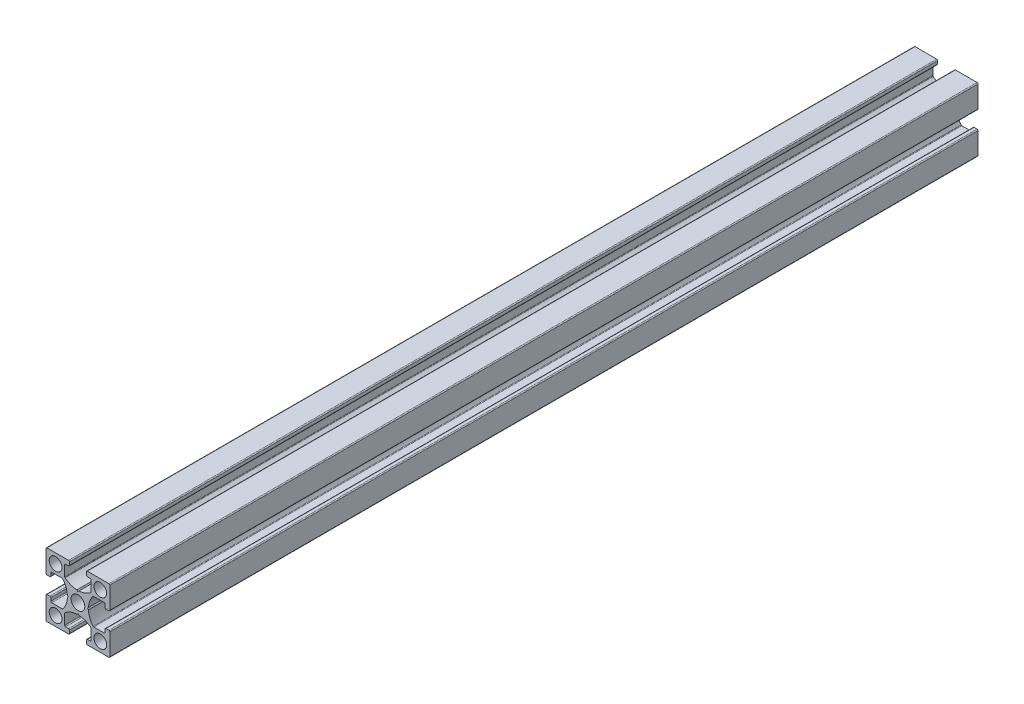
from build123d import *

# Parameters (mm, degrees)
MODEL_R         = 2.15
MODEL_R_2       = 2
EXTRUDE_1_DEPTH = 272


with BuildPart() as part:
    # Model → 보스-돌출1 (new body)
    with BuildSketch(Plane.XY):
        with BuildLine():
            Line((2307.763927197, 1192.134297913), (2307.763927197, 1195.391548465))
            ThreePointArc((2307.763927197, 1195.391548465), (2307.676059232, 1195.603680499), (2307.463927197, 1195.691548465))
            Line((2307.463927197, 1195.691548465), (2306.563927197, 1195.691548465))
            ThreePointArc((2306.563927197, 1195.691548465), (2306.351795163, 1195.779416431), (2306.263927197, 1195.991548465))
            Line((2306.263927197, 1195.991548465), (2306.263927197, 1196.891548465))
            ThreePointArc((2306.263927197, 1196.891548465), (2306.351795163, 1197.103680499), (2306.563927197, 1197.191548465))
            Line((2306.563927197, 1197.191548465), (2313.313927197, 1197.191548465))
            ThreePointArc((2313.313927197, 1197.191548465), (2313.526059232, 1197.103680499), (2313.613927197, 1196.891548465))
            Line((2313.613927197, 1196.891548465), (2313.613927197, 1190.141548465))
            ThreePointArc((2313.613927197, 1190.141548465), (2313.526059232, 1189.929416431), (2313.313927197, 1189.841548465))
            Line((2313.313927197, 1189.841548465), (2312.413927197, 1189.841548465))
            ThreePointArc((2312.413927197, 1189.841548465), (2312.201795163, 1189.929416431), (2312.113927197, 1190.141548465))
            Line((2312.113927197, 1190.141548465), (2312.113927197, 1191.041548465))
            ThreePointArc((2312.113927197, 1191.041548465), (2312.026059232, 1191.253680499), (2311.813927197, 1191.341548465))
            Line((2311.813927197, 1191.341548465), (2308.556676645, 1191.341548465))
            ThreePointArc((2308.556676645, 1191.341548465), (2308.426234796, 1191.311705686), (2308.321744595, 1191.228114625))
            ThreePointArc((2308.321744595, 1191.228114625), (2307.328306374, 1189.47356999), (2306.921204563, 1187.498825831))
            Line((2306.921204563, 1187.498825831), (2306.613927197, 1187.191548465))
            Line((2306.613927197, 1187.191548465), (2306.921204563, 1186.884271099))
            ThreePointArc((2306.921204563, 1186.884271099), (2307.328306374, 1184.90952694), (2308.321744595, 1183.154982305))
            ThreePointArc((2308.321744595, 1183.154982305), (2308.426234796, 1183.071391244), (2308.556676645, 1183.041548465))
            Line((2308.556676645, 1183.041548465), (2311.813927197, 1183.041548465))
            ThreePointArc((2311.813927197, 1183.041548465), (2312.026059232, 1183.129416431), (2312.113927197, 1183.341548465))
            Line((2312.113927197, 1183.341548465), (2312.113927197, 1184.241548465))
            ThreePointArc((2312.113927197, 1184.241548465), (2312.201795163, 1184.453680499), (2312.413927197, 1184.541548465))
            Line((2312.413927197, 1184.541548465), (2313.313927197, 1184.541548465))
            ThreePointArc((2313.313927197, 1184.541548465), (2313.526059232, 1184.453680499), (2313.613927197, 1184.241548465))
            Line((2313.613927197, 1184.241548465), (2313.613927197, 1177.491548465))
            ThreePointArc((2313.613927197, 1177.491548465), (2313.526059232, 1177.279416431), (2313.313927197, 1177.191548465))
            Line((2313.313927197, 1177.191548465), (2306.563927197, 1177.191548465))
            ThreePointArc((2306.563927197, 1177.191548465), (2306.351795163, 1177.279416431), (2306.263927197, 1177.491548465))
            Line((2306.263927197, 1177.491548465), (2306.263927197, 1178.391548465))
            ThreePointArc((2306.263927197, 1178.391548465), (2306.351795163, 1178.603680499), (2306.563927197, 1178.691548465))
            Line((2306.563927197, 1178.691548465), (2307.463927197, 1178.691548465))
            ThreePointArc((2307.463927197, 1178.691548465), (2307.676059232, 1178.779416431), (2307.763927197, 1178.991548465))
            Line((2307.763927197, 1178.991548465), (2307.763927197, 1182.248799017))
            ThreePointArc((2307.763927197, 1182.248799017), (2307.734084418, 1182.379240866), (2307.650493357, 1182.483731067))
            ThreePointArc((2307.650493357, 1182.483731067), (2305.895948722, 1183.477169289), (2303.921204563, 1183.884271099))
            Line((2303.921204563, 1183.884271099), (2303.613927197, 1184.191548465))
            Line((2303.613927197, 1184.191548465), (2303.306649831, 1183.884271099))
            ThreePointArc((2303.306649831, 1183.884271099), (2301.331905673, 1183.477169289), (2299.577361038, 1182.483731067))
            ThreePointArc((2299.577361038, 1182.483731067), (2299.493769977, 1182.379240866), (2299.463927197, 1182.248799017))
            Line((2299.463927197, 1182.248799017), (2299.463927197, 1178.991548465))
            ThreePointArc((2299.463927197, 1178.991548465), (2299.551795163, 1178.779416431), (2299.763927197, 1178.691548465))
            Line((2299.763927197, 1178.691548465), (2300.663927197, 1178.691548465))
            ThreePointArc((2300.663927197, 1178.691548465), (2300.876059232, 1178.603680499), (2300.963927197, 1178.391548465))
            Line((2300.963927197, 1178.391548465), (2300.963927197, 1177.491548465))
            ThreePointArc((2300.963927197, 1177.491548465), (2300.876059232, 1177.279416431), (2300.663927197, 1177.191548465))
            Line((2300.663927197, 1177.191548465), (2293.913927197, 1177.191548465))
            ThreePointArc((2293.913927197, 1177.191548465), (2293.701795163, 1177.279416431), (2293.613927197, 1177.491548465))
            Line((2293.613927197, 1177.491548465), (2293.613927197, 1184.241548465))
            ThreePointArc((2293.613927197, 1184.241548465), (2293.701795163, 1184.453680499), (2293.913927197, 1184.541548465))
            Line((2293.913927197, 1184.541548465), (2294.813927197, 1184.541548465))
            ThreePointArc((2294.813927197, 1184.541548465), (2295.026059232, 1184.453680499), (2295.113927197, 1184.241548465))
            Line((2295.113927197, 1184.241548465), (2295.113927197, 1183.341548465))
            ThreePointArc((2295.113927197, 1183.341548465), (2295.201795163, 1183.129416431), (2295.413927197, 1183.041548465))
            Line((2295.413927197, 1183.041548465), (2298.671177749, 1183.041548465))
            ThreePointArc((2298.671177749, 1183.041548465), (2298.801619599, 1183.071391244), (2298.906109799, 1183.154982305))
            ThreePointArc((2298.906109799, 1183.154982305), (2299.899548021, 1184.90952694), (2300.306649831, 1186.884271099))
            Line((2300.306649831, 1186.884271099), (2300.613927197, 1187.191548465))
            Line((2300.613927197, 1187.191548465), (2300.306649831, 1187.498825831))
            ThreePointArc((2300.306649831, 1187.498825831), (2299.899548021, 1189.47356999), (2298.906109799, 1191.228114625))
            ThreePointArc((2298.906109799, 1191.228114625), (2298.801619599, 1191.311705686), (2298.671177749, 1191.341548465))
            Line((2298.671177749, 1191.341548465), (2295.413927197, 1191.341548465))
            ThreePointArc((2295.413927197, 1191.341548465), (2295.201795163, 1191.253680499), (2295.113927197, 1191.041548465))
            Line((2295.113927197, 1191.041548465), (2295.113927197, 1190.141548465))
            ThreePointArc((2295.113927197, 1190.141548465), (2295.026059232, 1189.929416431), (2294.813927197, 1189.841548465))
            Line((2294.813927197, 1189.841548465), (2293.913927197, 1189.841548465))
            ThreePointArc((2293.913927197, 1189.841548465), (2293.701795163, 1189.929416431), (2293.613927197, 1190.141548465))
            Line((2293.613927197, 1190.141548465), (2293.613927197, 1196.891548465))
            ThreePointArc((2293.613927197, 1196.891548465), (2293.701795163, 1197.103680499), (2293.913927197, 1197.191548465))
            Line((2293.913927197, 1197.191548465), (2300.663927197, 1197.191548465))
            ThreePointArc((2300.663927197, 1197.191548465), (2300.876059232, 1197.103680499), (2300.963927197, 1196.891548465))
            Line((2300.963927197, 1196.891548465), (2300.963927197, 1195.991548465))
            ThreePointArc((2300.963927197, 1195.991548465), (2300.876059232, 1195.779416431), (2300.663927197, 1195.691548465))
            Line((2300.663927197, 1195.691548465), (2299.763927197, 1195.691548465))
            ThreePointArc((2299.763927197, 1195.691548465), (2299.551795163, 1195.603680499), (2299.463927197, 1195.391548465))
            Line((2299.463927197, 1195.391548465), (2299.463927197, 1192.134297913))
            ThreePointArc((2299.463927197, 1192.134297913), (2299.493769977, 1192.003856063), (2299.577361038, 1191.899365863))
            ThreePointArc((2299.577361038, 1191.899365863), (2301.331905673, 1190.905927641), (2303.306649831, 1190.498825831))
            Line((2303.306649831, 1190.498825831), (2303.613927197, 1190.191548465))
            Line((2303.613927197, 1190.191548465), (2303.921204563, 1190.498825831))
            ThreePointArc((2303.921204563, 1190.498825831), (2305.895948722, 1190.905927641), (2307.650493357, 1191.899365863))
            ThreePointArc((2307.650493357, 1191.899365863), (2307.734084418, 1192.003856063), (2307.763927197, 1192.134297913))
        make_face()
        with Locations((2303.613927197, 1187.191548465)):
            Circle(MODEL_R, mode=Mode.SUBTRACT)
        with Locations((2296.613927197, 1194.191548465)):
            Circle(MODEL_R_2, mode=Mode.SUBTRACT)
        with Locations((2296.613927197, 1180.191548465)):
            Circle(MODEL_R_2, mode=Mode.SUBTRACT)
        with Locations((2310.613927197, 1194.191548465)):
            Circle(MODEL_R_2, mode=Mode.SUBTRACT)
        with Locations((2310.613927197, 1180.191548465)):
            Circle(MODEL_R_2, mode=Mode.SUBTRACT)
    extrude(amount=EXTRUDE_1_DEPTH)


solid = part.part
